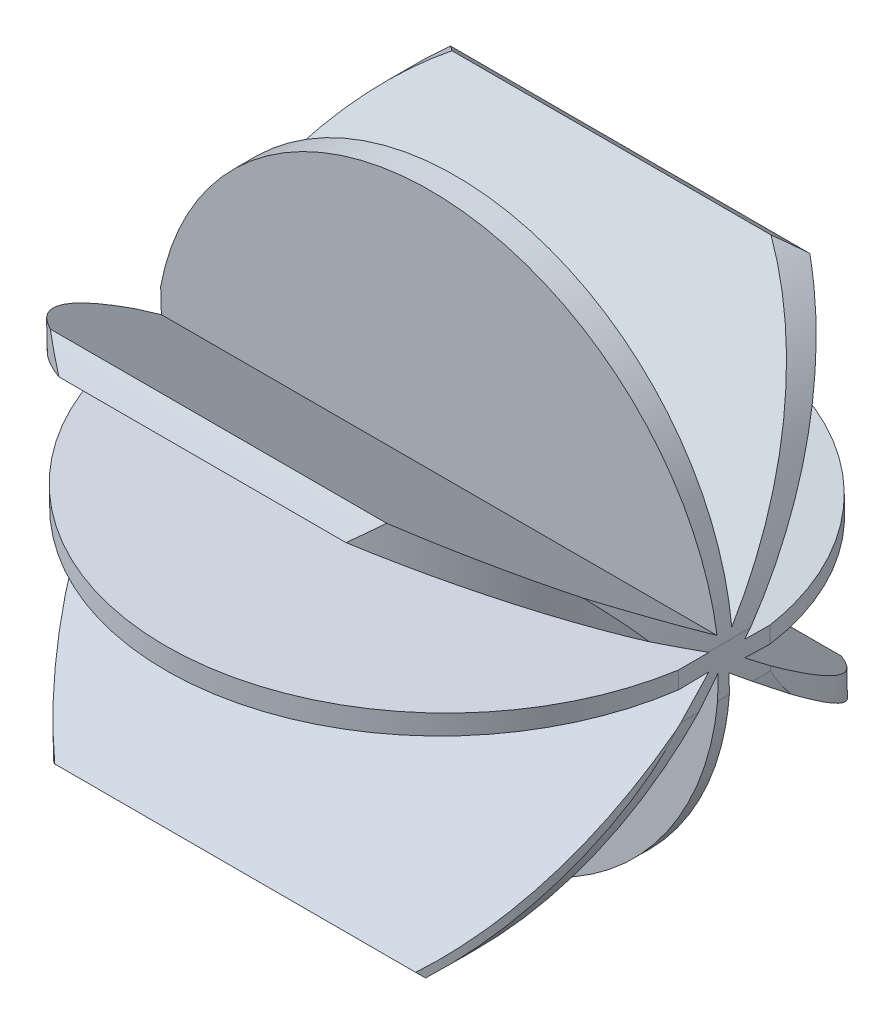
from build123d import *

# Parameters (mm, degrees)
SKETCH1_R               = 58.499168585
BOSS_EXTRUDE1_DEPTH     = 95
CUT_EXTRUDE3_DEPTH      = 100
SKETCH4_W               = 9.373072574
SKETCH4_H               = 2.086863183
SKETCH4_W_2             = 2.476243421
SKETCH4_H_2             = 12.533404649
CUT_EXTRUDE4_DEPTH      = 127.730498931
SKETCH5_R               = 85.185879132
SKETCH5_R_2             = 48.091620782
CUT_EXTRUDE6_DEPTH      = 162.424468201
CUT_EXTRUDE9_DEPTH      = 123.740942834
CUT_EXTRUDE9_DEPTH_BACK = 123.740942834
SKETCH6_R               = 79.179320002
SKETCH6_R_2             = 47.965553318
SKETCH7_R               = 65.670207134
SKETCH7_R_2             = 49.501482781
CUT_EXTRUDE11_DEPTH     = 100


with BuildPart() as part:
    # Sketch1 → Boss-Extrude1 (new body)
    with BuildSketch(Plane(origin=(0, 0, 0), x_dir=(0, 0, -1), z_dir=(1, 0, 0))):
        with Locations((-1.612948614, 0)):
            Circle(SKETCH1_R)
    extrude(amount=BOSS_EXTRUDE1_DEPTH)

    # Sketch2 → Cut-Extrude3 (cut)
    with BuildSketch(Plane.ZY):
        Polygon((-34.616587509, 50.080454684), (-34.616587509, 62.895572105), (-0.820688819, 58.448525507), (0, 3.58366071), (-34.293670433, 46.428785299), align=None)
        with BuildLine():
            Line((-37.468242519, 43.529452383), (-2.046271026, 0.817665198))
            Line((-2.046271026, 0.817665198), (-56.886219972, 0))
            add(Edge.make_bspline(
                [(-37.468242519, 43.529452383), (-81.726208007, 46.47230528), (-56.886219972, 0)],
                knots=[0, 0, 0, 1, 1, 1], degree=2))
        make_face()
        with BuildLine():
            Line((-56.773526724, -3.629355702), (-2.046271026, -1.930047978))
            Line((-2.046271026, -1.930047978), (-45.251031563, -35.013141635))
            add(Edge.make_bspline(
                [(-56.773526724, -3.629355702), (-82.637840847, -33.762491691), (-45.251031563, -35.013141635)],
                knots=[0, 0, 0, 1, 1, 1], degree=2))
        make_face()
        with BuildLine():
            Line((-42.78323994, -38.093715585), (0.600944507, -2.836333045))
            Line((0.600944507, -2.836333045), (0, -58.476928116))
            add(Edge.make_bspline(
                [(-42.78323994, -38.093715585), (-42.157907188, -81.245363376), (0, -58.476928116)],
                knots=[0, 0, 0, 1, 1, 1], degree=2))
        make_face()
        with BuildLine():
            Line((3.225897227, -58.476928116), (2.505757473, -1.930047978))
            Line((2.505757473, -1.930047978), (37.676550811, -46.060496325))
            add(Edge.make_bspline(
                [(37.676550811, -46.060496325), (44.967631713, -79.6133954), (3.225897227, -58.476928116)],
                knots=[0, 0, 0, 1, 1, 1], degree=2))
        make_face()
        with BuildLine():
            Line((42.352672899, -41.981276663), (4.046586047, -0.931979638))
            Line((4.046586047, -0.931979638), (60.080269742, -1.930047978))
            add(Edge.make_bspline(
                [(60.080269742, -1.930047978), (94.049932739, -36.726987631), (42.352672899, -41.981276663)],
                knots=[0, 0, 0, 1, 1, 1], degree=2))
        make_face()
        with BuildLine():
            Line((60.080269742, 1.930047978), (4.046586047, 1.930047978))
            Line((4.046586047, 1.930047978), (51.077950448, 31.230855234))
            add(Edge.make_bspline(
                [(51.077950448, 31.230855234), (102.146773926, 32.028777375), (60.080269742, 1.930047978)],
                knots=[0, 0, 0, 1, 1, 1], degree=2))
        make_face()
        with BuildLine():
            Line((48.248640535, 35.316638631), (2.505757473, 3.58366071))
            Line((2.505757473, 3.58366071), (4.046586047, 58.448525507))
            add(Edge.make_bspline(
                [(4.046586047, 58.448525507), (39.246107014, 77.741383534), (48.248640535, 35.316638631)],
                knots=[0, 0, 0, 1, 1, 1], degree=2))
        make_face()
    extrude(amount=-CUT_EXTRUDE3_DEPTH, mode=Mode.SUBTRACT)

    # Sketch4 → Cut-Extrude4 (cut, through all)
    with BuildSketch(Plane.ZY):
        with Locations((2.834262756, 59.310645652)):
            Rectangle(SKETCH4_W, SKETCH4_H)
        with Locations((-57.79093587, -1.746234162)):
            Rectangle(SKETCH4_W_2, SKETCH4_H_2)
    extrude(amount=-CUT_EXTRUDE4_DEPTH, mode=Mode.SUBTRACT)

    # Sketch5 → Cut-Extrude6 (cut, through all)
    with BuildSketch(Plane(origin=(0, 0, -56.552814159), x_dir=(-1, 0, 0), z_dir=(0, 0, -1))):
        with Locations((-47.078327147, -2.012615685)):
            Circle(SKETCH5_R)
        with Locations((-47.078327147, -2.012615685)):
            Circle(SKETCH5_R_2, mode=Mode.SUBTRACT)
    extrude(amount=-CUT_EXTRUDE6_DEPTH, mode=Mode.SUBTRACT)

    # Sketch6 → Cut-Extrude9 (cut, two sides: drawn at the far end of the back side and taken through both)
    with BuildSketch(Plane(origin=(0, -0.859629379, -0.015311663), x_dir=(-1, 0, 0), z_dir=(0, -0.9998414052195305, -0.017809110270727707)).offset(-CUT_EXTRUDE9_DEPTH_BACK)):
        with Locations((-47.673789364, -1.454840891)):
            Circle(SKETCH6_R)
        with Locations((-47.673789364, -1.454840891)):
            Circle(SKETCH6_R_2, mode=Mode.SUBTRACT)
    extrude(amount=CUT_EXTRUDE9_DEPTH + CUT_EXTRUDE9_DEPTH_BACK, mode=Mode.SUBTRACT)

    # Sketch7 → Cut-Extrude11 (cut)
    with BuildSketch(Plane(origin=(95, 0, 0), x_dir=(0, 0, -1), z_dir=(1, 0, 0))):
        with Locations((-2.505757473, -1.930047978)):
            Circle(SKETCH7_R)
        with Locations((-2.505757473, -1.930047978)):
            Circle(SKETCH7_R_2, mode=Mode.SUBTRACT)
    extrude(amount=-CUT_EXTRUDE11_DEPTH, mode=Mode.SUBTRACT)


solid = part.part
